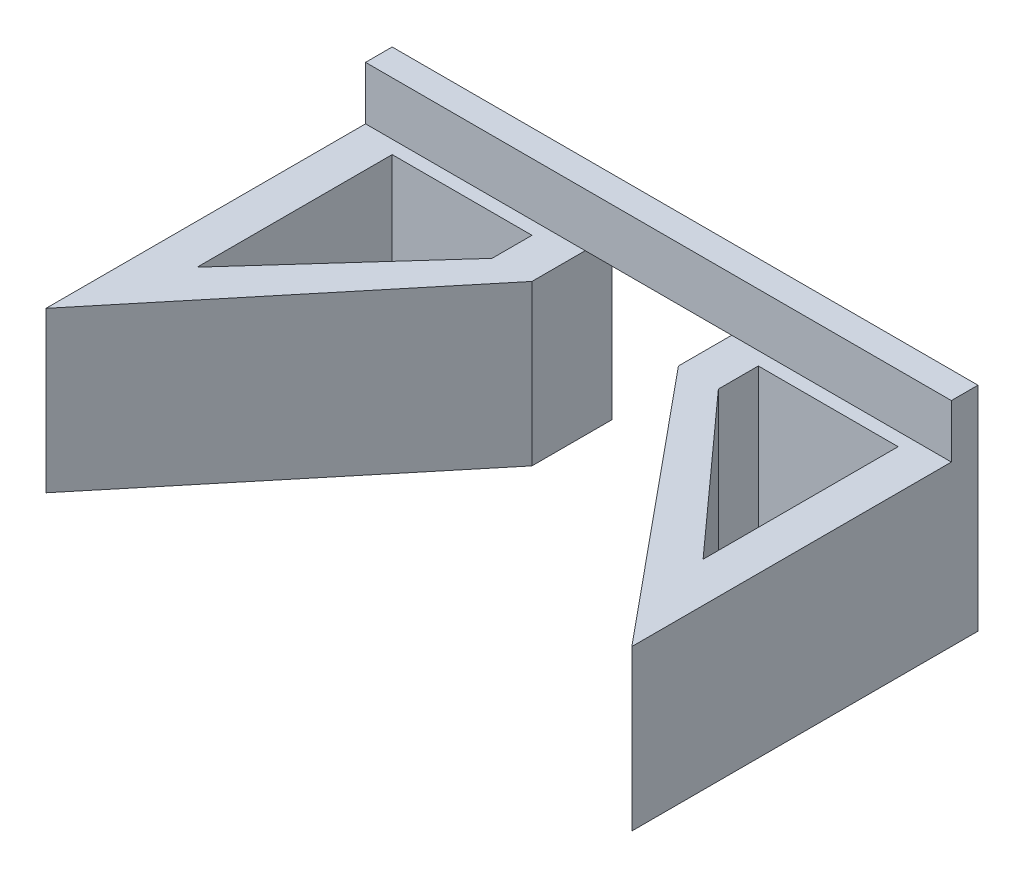
from build123d import *

# Parameters (mm, degrees)
BOSS_EXTRUDE1_DEPTH   = 60
BOSS_EXTRUDE1_2_DEPTH = 60
SKETCH3_W             = 220
SKETCH3_H             = 10
BOSS_EXTRUDE3_DEPTH   = 20


with BuildPart() as part:
    # Sketch1 → Boss-Extrude1 (new body)
    with BuildSketch(Plane(origin=(0, 0, 0), x_dir=(1, 0, 0), z_dir=(0, 1, 0))):
        Polygon((-110, 12.700803213), (-110, -87.299196787), (-27.5, 12.700803213), (-27.5, 42.700803213), (-110, 42.700803213), align=None)
        Polygon((-95, 27.700803213), (-95, -45.546665583), (-42.5, 12.700803213), (-42.5, 27.700803213), align=None, mode=Mode.SUBTRACT)
    extrude(amount=BOSS_EXTRUDE1_DEPTH)



with BuildPart() as body_2:
    # Sketch1 → Boss-Extrude1 2 (new body)
    with BuildSketch(Plane(origin=(0, 0, 0), x_dir=(1, 0, 0), z_dir=(0, 1, 0))):
        Polygon((110, 42.700803213), (27.5, 42.700803213), (27.5, 12.700803213), (110, -87.299196787), (110, 12.700803213), align=None)
        Polygon((42.5, 12.700803213), (42.5, 27.700803213), (95, 27.700803213), (95, -45.546665583), align=None, mode=Mode.SUBTRACT)
    extrude(amount=BOSS_EXTRUDE1_2_DEPTH)


with BuildPart() as part_1:
    add(part.part)

    add(body_2.part)  # Boss-Extrude3 merges body 2
    # Sketch3 → Boss-Extrude3 (add)
    with BuildSketch(Plane(origin=(0, 60, 0), x_dir=(1, 0, 0), z_dir=(0, 1, 0))):
        with Locations((0, 37.700803213)):
            Rectangle(SKETCH3_W, SKETCH3_H)
    extrude(amount=BOSS_EXTRUDE3_DEPTH)


solid = part_1.part
